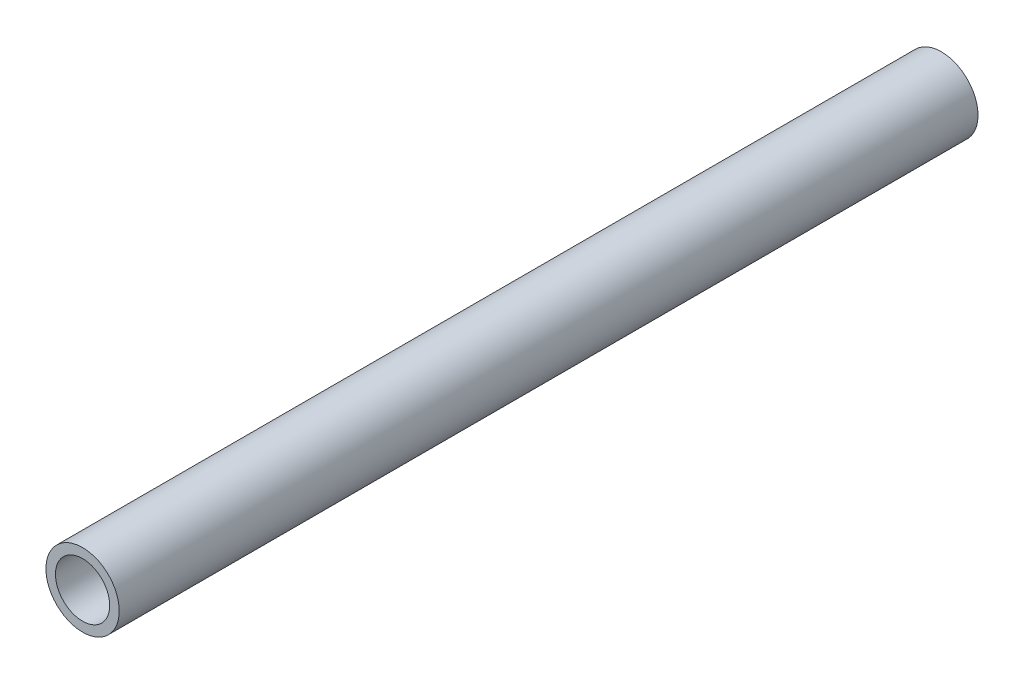
from build123d import *

# Parameters (mm, degrees)
SKETCH1_R           = 10.668
SKETCH1_R_2         = 7.8994
EXTRUDE_THIN1_DEPTH = 125


with BuildPart() as part:
    # Sketch1 → Extrude-Thin1 (new, symmetric)
    with BuildSketch(Plane.XY):
        Circle(SKETCH1_R)
        Circle(SKETCH1_R_2, mode=Mode.SUBTRACT)
    extrude(amount=EXTRUDE_THIN1_DEPTH, both=True)


solid = part.part
